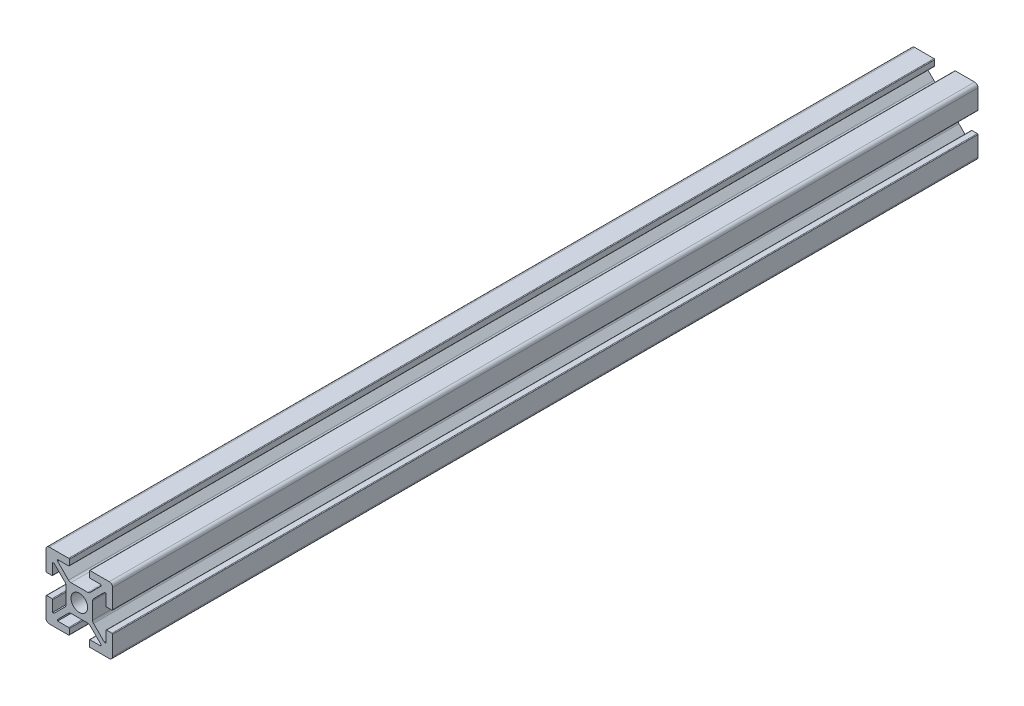
from build123d import *

# Parameters (mm, degrees)
SKETCH1_R           = 2.5
BOSS_EXTRUDE1_DEPTH = 260


with BuildPart() as part:
    # Sketch1 → Boss-Extrude1 (new body)
    with BuildSketch(Plane.XY):
        with BuildLine():
            Line((0.2, 13), (1.8, 13))
            ThreePointArc((1.8, 13), (1.941421356, 13.058578644), (2, 13.2))
            Line((2, 13.2), (2, 16.5))
            Line((2, 16.5), (2.439339828, 16.5))
            Line((2.439339828, 16.5), (5.707106781, 13.232233047))
            ThreePointArc((5.707106781, 13.232233047), (5.923879533, 12.907809698), (6, 12.525126266))
            Line((6, 12.525126266), (6, 7.474873734))
            ThreePointArc((6, 7.474873734), (5.923879533, 7.092190302), (5.707106781, 6.767766953))
            Line((5.707106781, 6.767766953), (2.439339828, 3.5))
            Line((2.439339828, 3.5), (2, 3.5))
            Line((2, 3.5), (2, 6.8))
            ThreePointArc((2, 6.8), (1.941421356, 6.941421356), (1.8, 7))
            Line((1.8, 7), (0.2, 7))
            ThreePointArc((0.2, 7), (0.058578644, 6.941421356), (0, 6.8))
            Line((0, 6.8), (0, 1))
            ThreePointArc((0, 1), (0.292893219, 0.292893219), (1, 0))
            Line((1, 0), (6.8, 0))
            ThreePointArc((6.8, 0), (6.941421356, 0.058578644), (7, 0.2))
            Line((7, 0.2), (7, 1.8))
            ThreePointArc((7, 1.8), (6.941421356, 1.941421356), (6.8, 2))
            Line((6.8, 2), (3.5, 2))
            Line((3.5, 2), (3.5, 2.439339828))
            Line((3.5, 2.439339828), (6.767766953, 5.707106781))
            ThreePointArc((6.767766953, 5.707106781), (7.092190302, 5.923879533), (7.474873734, 6))
            Line((7.474873734, 6), (10, 6))
            Line((10, 6), (12.525126266, 6))
            ThreePointArc((12.525126266, 6), (12.907809698, 5.923879533), (13.232233047, 5.707106781))
            Line((13.232233047, 5.707106781), (16.5, 2.439339828))
            Line((16.5, 2.439339828), (16.5, 2))
            Line((16.5, 2), (13.2, 2))
            ThreePointArc((13.2, 2), (13.058578644, 1.941421356), (13, 1.8))
            Line((13, 1.8), (13, 0.2))
            ThreePointArc((13, 0.2), (13.058578644, 0.058578644), (13.2, 0))
            Line((13.2, 0), (19, 0))
            ThreePointArc((19, 0), (19.707106781, 0.292893219), (20, 1))
            Line((20, 1), (20, 6.8))
            ThreePointArc((20, 6.8), (19.941421356, 6.941421356), (19.8, 7))
            Line((19.8, 7), (18.2, 7))
            ThreePointArc((18.2, 7), (18.058578644, 6.941421356), (18, 6.8))
            Line((18, 6.8), (18, 3.5))
            Line((18, 3.5), (17.560660172, 3.5))
            Line((17.560660172, 3.5), (14.292893219, 6.767766953))
            ThreePointArc((14.292893219, 6.767766953), (14.076120467, 7.092190302), (14, 7.474873734))
            Line((14, 7.474873734), (14, 12.525126266))
            ThreePointArc((14, 12.525126266), (14.076120467, 12.907809698), (14.292893219, 13.232233047))
            Line((14.292893219, 13.232233047), (17.560660172, 16.5))
            Line((17.560660172, 16.5), (18, 16.5))
            Line((18, 16.5), (18, 13.2))
            ThreePointArc((18, 13.2), (18.058578644, 13.058578644), (18.2, 13))
            Line((18.2, 13), (19.8, 13))
            ThreePointArc((19.8, 13), (19.941421356, 13.058578644), (20, 13.2))
            Line((20, 13.2), (20, 19))
            ThreePointArc((20, 19), (19.707106781, 19.707106781), (19, 20))
            Line((19, 20), (13.2, 20))
            ThreePointArc((13.2, 20), (13.058578644, 19.941421356), (13, 19.8))
            Line((13, 19.8), (13, 18.2))
            ThreePointArc((13, 18.2), (13.058578644, 18.058578644), (13.2, 18))
            Line((13.2, 18), (16.5, 18))
            Line((16.5, 18), (16.5, 17.560660172))
            Line((16.5, 17.560660172), (13.232233047, 14.292893219))
            ThreePointArc((13.232233047, 14.292893219), (12.907809698, 14.076120467), (12.525126266, 14))
            Line((12.525126266, 14), (10, 14))
            Line((10, 14), (7.474873734, 14))
            ThreePointArc((7.474873734, 14), (7.092190302, 14.076120467), (6.767766953, 14.292893219))
            Line((6.767766953, 14.292893219), (3.5, 17.560660172))
            Line((3.5, 17.560660172), (3.5, 18))
            Line((3.5, 18), (6.8, 18))
            ThreePointArc((6.8, 18), (6.941421356, 18.058578644), (7, 18.2))
            Line((7, 18.2), (7, 19.8))
            ThreePointArc((7, 19.8), (6.941421356, 19.941421356), (6.8, 20))
            Line((6.8, 20), (1, 20))
            ThreePointArc((1, 20), (0.292893219, 19.707106781), (0, 19))
            Line((0, 19), (0, 13.2))
            ThreePointArc((0, 13.2), (0.058578644, 13.058578644), (0.2, 13))
        make_face()
        with Locations((10, 10)):
            Circle(SKETCH1_R, mode=Mode.SUBTRACT)
    extrude(amount=BOSS_EXTRUDE1_DEPTH)


solid = part.part
